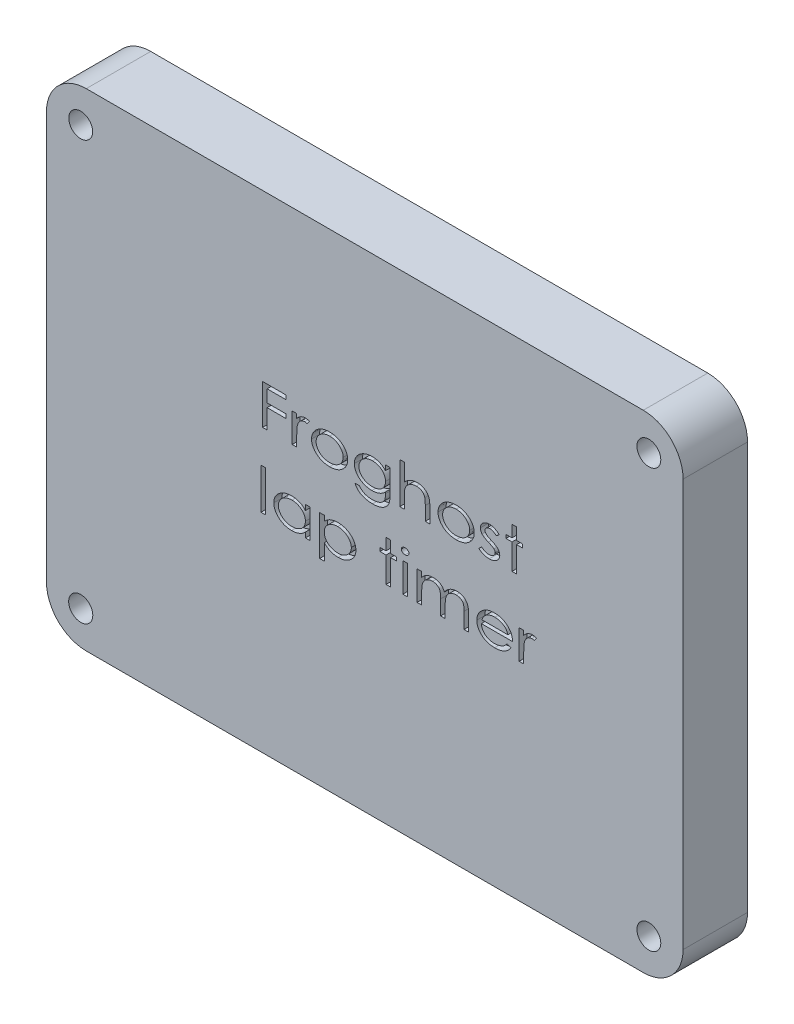
from build123d import *

# Parameters (mm, degrees)
ESQUISSE1_W             = 80
ESQUISSE1_H             = 61.2
ESQUISSE1_R             = 1.5
ESQUISSE1_R_2           = 1.497381554
ESQUISSE1_R_3           = 1.516159075
BOSS_EXTRU_1_DEPTH      = 6.1
ESQUISSE2_W             = 80
ESQUISSE2_H             = 61.2
BOSS_EXTRU_2_DEPTH      = 2
CONG_1_R                = 5
ESQUISSE3_R             = 1.5
ESQUISSE3_R_2           = 1.516159075
ESQUISSE3_R_3           = 1.497381554
ENL_V_MAT_EXTRU_1_DEPTH = 18
ESQUISSE4_W             = 0.576923077
ESQUISSE4_H             = 5.128205128
ESQUISSE4_H_2           = 3.653846154
ENL_V_MAT_EXTRU_2_DEPTH = 1


with BuildPart() as part:
    # Esquisse1 → Boss.-Extru.1 (new body)
    with BuildSketch(Plane.XY):
        with Locations((11.099287317, -7.392133332)):
            Rectangle(ESQUISSE1_W, ESQUISSE1_H)
        with Locations((-24.600712683, 18.907866668)):
            Circle(ESQUISSE1_R, mode=Mode.SUBTRACT)
        with Locations((46.799287317, 18.907866668)):
            Circle(ESQUISSE1_R, mode=Mode.SUBTRACT)
        with Locations((46.799866202, -33.694686986)):
            Circle(ESQUISSE1_R_2, mode=Mode.SUBTRACT)
        with Locations((-24.596108716, -33.707622657)):
            Circle(ESQUISSE1_R_3, mode=Mode.SUBTRACT)
        with BuildLine():
            Line((-22.700712683, 21.207866668), (44.696667897, 21.207866668))
            ThreePointArc((44.696667897, 21.207866668), (44.797977607, 16.906556958), (49.099287317, 17.007866668))
            Line((49.099287317, 17.007866668), (49.099287317, -31.792133332))
            ThreePointArc((49.099287317, -31.792133332), (44.92039338, -31.813239396), (44.899287317, -35.992133332))
            Line((44.899287317, -35.992133332), (-22.700712683, -35.992133332))
            ThreePointArc((-22.700712683, -35.992133332), (-22.700712683, -31.792133332), (-26.900712683, -31.792133332))
            Line((-26.900712683, -31.792133332), (-26.900712683, 17.007866668))
            ThreePointArc((-26.900712683, 17.007866668), (-22.491210372, 16.798364357), (-22.700712683, 21.207866668))
        make_face(mode=Mode.SUBTRACT)
    extrude(amount=BOSS_EXTRU_1_DEPTH)

    # Esquisse2 → Boss.-Extru.2 (add)
    with BuildSketch(Plane.XY.offset(6.1)):
        with Locations((11.099287317, -7.392133332)):
            Rectangle(ESQUISSE2_W, ESQUISSE2_H)
    extrude(amount=BOSS_EXTRU_2_DEPTH)

    # Congé1
    cong_1_edges = [part.edges().sort_by_distance(p)[0] for p in [
        (-28.900712683, 23.207866668, 4.05),
        (51.099287317, 23.207866668, 4.05),
        (51.099287317, -37.992133332, 4.05),
        (-28.900712683, -37.992133332, 4.05),
    ]]
    fillet(cong_1_edges, radius=CONG_1_R)

    # Esquisse3 → Enlèv. mat.-Extru.1 (cut)
    with BuildSketch(Plane(origin=(0, 0, 0), x_dir=(-1, 0, 0), z_dir=(0, 0, -1))):
        with Locations(Location((-46.799287317, 18.907866668, 0), (0, 0, 180))):
            Circle(ESQUISSE3_R)
        with Locations(Location((24.600712683, 18.907866668, 0), (0, 0, 180))):
            Circle(ESQUISSE3_R)
        with Locations(Location((24.596108716, -33.707622657, 0), (0, 0, 180))):
            Circle(ESQUISSE3_R_2)
        with Locations(Location((-46.799866202, -33.694686986, 0), (0, 0, 180))):
            Circle(ESQUISSE3_R_3)
    extrude(amount=-ENL_V_MAT_EXTRU_1_DEPTH, mode=Mode.SUBTRACT)

    # Esquisse4 → Enlèv. mat.-Extru.2 (cut)
    # profile 1 of 17: a face of its own
    with BuildSketch(Plane.XY.offset(8.1)):
        Polygon((-1.7457889, 2.417352805), (1.202929049, 2.417352805), (1.202929049, 1.904532292), (-1.168865823, 1.904532292), (-1.168865823, 0.366070754), (1.202929049, 0.366070754), (1.202929049, -0.146749759), (-1.168865823, -0.146749759), (-1.168865823, -2.582647195), (-1.7457889, -2.582647195), align=None)
    # profile 2 of 17: a face of its own
    with BuildSketch(Plane.XY.offset(8.1)):
        with BuildLine():
            Line((1.972159818, 1.071198959), (2.549082895, 1.071198959))
            Line((2.549082895, 1.071198959), (2.549082895, 0.533338382))
            add(Edge.make_bspline(
                [(2.549082895, 0.533338382), (2.590898267, 0.58357823), (2.671555938, 0.680485871), (2.803193509, 0.807416125), (2.938487436, 0.912067037), (3.077485244, 0.995077542), (3.220253854, 1.057255576), (3.365037599, 1.103312586), (3.513656403, 1.129815272), (3.613686509, 1.133468755), (3.663866549, 1.135301523)],
                knots=[0, 0, 0, 0, 1.193658677, 2.302448217, 3.333465471, 4.312705537, 5.252324839, 6.172656765, 7.083314411, 8, 8, 8, 8], degree=3))
            add(Edge.make_bspline(
                [(3.663866549, 1.135301523), (3.702698242, 1.133600336), (3.782334933, 1.130111511), (3.903060423, 1.105877857), (4.027640721, 1.066470265), (4.109269099, 1.029364763), (4.151646997, 1.010101203)],
                knots=[0, 0, 0, 0, 0.917703527, 1.882041823, 2.900448349, 4, 4, 4, 4], degree=3))
            Line((4.151646997, 1.010101203), (3.859179049, 0.621479408))
            add(Edge.make_bspline(
                [(3.859179049, 0.621479408), (3.831551033, 0.631073725), (3.779357929, 0.649198702), (3.703494637, 0.671338009), (3.63389818, 0.683723854), (3.589452859, 0.685673741), (3.568714305, 0.686583574)],
                knots=[0, 0, 0, 0, 1.173299391, 2.216523101, 3.167814971, 4, 4, 4, 4], degree=3))
            add(Edge.make_bspline(
                [(3.568714305, 0.686583574), (3.523066476, 0.684276898), (3.431350317, 0.679642295), (3.295926615, 0.641175619), (3.163391196, 0.580090448), (3.057500459, 0.510443596), (2.975364309, 0.44422088), (2.918466918, 0.385073085), (2.863999674, 0.320709111), (2.812622551, 0.249846436), (2.767210715, 0.170965199), (2.723628047, 0.086745689), (2.684714574, -0.004397743), (2.662552867, -0.068150507), (2.651246356, -0.100676041)],
                knots=[0, 0, 0, 0, 1.267924812, 2.547529573, 3.885648399, 5.315257258, 6.060816241, 6.816029851, 7.593692966, 8.405539728, 9.24650386, 10.122873872, 11.042323403, 12, 12, 12, 12], degree=3))
            add(Edge.make_bspline(
                [(2.651246356, -0.100676041), (2.64278989, -0.129612084), (2.624116167, -0.193509182), (2.604098925, -0.301142598), (2.587542966, -0.428573179), (2.574191651, -0.575639152), (2.561727685, -0.742210099), (2.554108942, -0.92860292), (2.550663053, -1.134984176), (2.549625598, -1.279227301), (2.549082895, -1.354682451)],
                knots=[0, 0, 0, 0, 0.573131189, 1.265598738, 2.079306811, 3.017055669, 4.073990921, 5.25627755, 6.564728891, 8, 8, 8, 8], degree=3))
            Line((2.549082895, -1.354682451), (2.549082895, -2.582647195))
            Line((2.549082895, -2.582647195), (1.972159818, -2.582647195))
            Line((1.972159818, -2.582647195), (1.972159818, 1.071198959))
        make_face()
    # profile 3 of 17: a face of its own
    with BuildSketch(Plane.XY.offset(8.1)):
        with BuildLine():
            add(Edge.make_bspline(
                [(6.685701485, 1.135301523), (6.767926636, 1.133814617), (6.929574644, 1.13089148), (7.166397364, 1.100621467), (7.392602791, 1.053895191), (7.60840326, 0.989223611), (7.812317472, 0.903286954), (8.005727127, 0.799789675), (8.188714818, 0.677360096), (8.300204344, 0.581589267), (8.356374561, 0.533338382)],
                knots=[0, 0, 0, 0, 1.084830271, 2.132688704, 3.145650297, 4.131276902, 5.101142159, 6.06133745, 7.023270615, 8, 8, 8, 8], degree=3))
            add(Edge.make_bspline(
                [(8.356374561, 0.533338382), (8.404464625, 0.48755832), (8.498789178, 0.397764639), (8.620442383, 0.249197944), (8.726200535, 0.096575552), (8.81217176, -0.063474431), (8.877002364, -0.230668061), (8.924376421, -0.403440638), (8.954819635, -0.582372092), (8.957822116, -0.704186083), (8.959339305, -0.765740143)],
                knots=[0, 0, 0, 0, 1.078139912, 2.114679361, 3.114009473, 4.092288667, 5.059596781, 6.02185444, 7.000419498, 8, 8, 8, 8], degree=3))
            add(Edge.make_bspline(
                [(8.959339305, -0.765740143), (8.957490079, -0.827638332), (8.953829291, -0.950173988), (8.92227784, -1.130457191), (8.873604103, -1.305541034), (8.802697178, -1.473887976), (8.71270937, -1.636959612), (8.602002703, -1.793013701), (8.471347869, -1.943094507), (8.323502488, -2.085817342), (8.160546896, -2.218030431), (7.983090067, -2.332152588), (7.795002277, -2.430327881), (7.5946264, -2.509004034), (7.383582623, -2.571516849), (7.160947288, -2.61527757), (6.927054347, -2.64156203), (6.767234327, -2.644997261), (6.685701485, -2.646749759)],
                knots=[0, 0, 0, 0, 0.904967769, 1.791503467, 2.669778811, 3.558773624, 4.457351764, 5.389732271, 6.352404915, 7.364552137, 8.392870792, 9.417144319, 10.446135616, 11.491962056, 12.561496981, 13.662177698, 14.807350315, 16, 16, 16, 16], degree=3))
            add(Edge.make_bspline(
                [(6.685701485, -2.646749759), (6.603834687, -2.64499877), (6.44334859, -2.641566252), (6.208463544, -2.615255582), (5.985126689, -2.57164742), (5.773748514, -2.509039072), (5.57321283, -2.430048103), (5.38444259, -2.332503837), (5.206803615, -2.217662582), (5.042917529, -2.086193389), (4.895157531, -1.942996548), (4.764248948, -1.793353091), (4.65482647, -1.636626872), (4.564638784, -1.473930918), (4.493808391, -1.305529742), (4.44511445, -1.130460216), (4.413568365, -0.950173211), (4.409906848, -0.827638071), (4.408057254, -0.765740143)],
                knots=[0, 0, 0, 0, 1.196045726, 2.344646605, 3.448747233, 4.516955666, 5.561485018, 6.593533137, 7.616536308, 8.647384558, 9.658276463, 10.61975515, 11.548176474, 12.445640151, 13.333532386, 14.210718448, 15.096154619, 16, 16, 16, 16], degree=3))
            add(Edge.make_bspline(
                [(4.408057254, -0.765740143), (4.409579841, -0.704516892), (4.412601129, -0.58303083), (4.443145272, -0.404491722), (4.489883185, -0.23166878), (4.556648524, -0.065929057), (4.641527251, 0.094161844), (4.74636342, 0.246995435), (4.86898769, 0.394775142), (4.96299764, 0.484498827), (5.011021997, 0.530333574)],
                knots=[0, 0, 0, 0, 0.996090355, 1.976554501, 2.9406796, 3.906810568, 4.879633339, 5.885394343, 6.919767756, 8, 8, 8, 8], degree=3))
            add(Edge.make_bspline(
                [(5.011021997, 0.530333574), (5.067135669, 0.578993753), (5.178354455, 0.675439517), (5.362176824, 0.797800821), (5.555783917, 0.902594591), (5.76097197, 0.987663148), (5.976575405, 1.054258457), (6.203358921, 1.100611549), (6.440823665, 1.130903624), (6.603140672, 1.133818767), (6.685701485, 1.135301523)],
                knots=[0, 0, 0, 0, 0.97674147, 1.935927491, 2.899331942, 3.870482242, 4.854580139, 5.864648857, 6.913876432, 8, 8, 8, 8], degree=3))
        make_face()
        with BuildLine():
            add(Edge.make_bspline(
                [(6.683698279, 0.686583574), (6.626549187, 0.685197088), (6.513899097, 0.6824641), (6.348345449, 0.662041469), (6.188921294, 0.628763417), (6.035320447, 0.583278631), (5.888229682, 0.522140286), (5.746815514, 0.449329005), (5.611634216, 0.362503574), (5.484992836, 0.263128049), (5.368249421, 0.154975619), (5.265671191, 0.039765004), (5.178770458, -0.080941461), (5.107725883, -0.207547526), (5.052469, -0.339958098), (5.013288085, -0.478125422), (4.989654097, -0.621698135), (4.9865537, -0.719243352), (4.984980331, -0.768744951)],
                knots=[0, 0, 0, 0, 1.104667212, 2.17747748, 3.219316569, 4.250544466, 5.269396084, 6.294241117, 7.321968413, 8.370404829, 9.402541342, 10.394730436, 11.347658633, 12.272385255, 13.19539825, 14.114815826, 15.043319244, 16, 16, 16, 16], degree=3))
            add(Edge.make_bspline(
                [(4.984980331, -0.768744951), (4.987546333, -0.832767373), (4.992657157, -0.960283745), (5.038029879, -1.147327737), (5.109533431, -1.327792478), (5.210262902, -1.498182011), (5.334224506, -1.656101397), (5.479229021, -1.797636404), (5.645564687, -1.91855758), (5.829935627, -2.019158417), (6.028711398, -2.099033389), (6.238844674, -2.155810484), (6.458052865, -2.192492705), (6.607762024, -2.19616774), (6.683698279, -2.19803181)],
                knots=[0, 0, 0, 0, 0.932622684, 1.857547055, 2.790779812, 3.75545055, 4.733536497, 5.711573951, 6.70118165, 7.723336121, 8.767798276, 9.81805688, 10.893263495, 12, 12, 12, 12], degree=3))
            add(Edge.make_bspline(
                [(6.683698279, -2.19803181), (6.759634535, -2.19616774), (6.909343694, -2.192492705), (7.128551885, -2.155810484), (7.338685161, -2.099033389), (7.537460932, -2.019158417), (7.721831871, -1.91855758), (7.888167538, -1.797636404), (8.033172053, -1.656101397), (8.157133657, -1.498182011), (8.257863128, -1.327792478), (8.32936668, -1.147327737), (8.374739401, -0.960283745), (8.379850226, -0.832767373), (8.382416228, -0.768744951)],
                knots=[0, 0, 0, 0, 1.106736505, 2.18194312, 3.232201724, 4.276663879, 5.29881835, 6.288426049, 7.266463503, 8.24454945, 9.209220188, 10.142452945, 11.067377316, 12, 12, 12, 12], degree=3))
            add(Edge.make_bspline(
                [(8.382416228, -0.768744951), (8.38080454, -0.719255769), (8.377628633, -0.621735019), (8.354531686, -0.477891866), (8.313276463, -0.340432039), (8.260223243, -0.206976537), (8.187325697, -0.081271622), (8.100796841, 0.039777879), (7.99811528, 0.155325295), (7.880391656, 0.262735805), (7.753706478, 0.362929328), (7.617880694, 0.448711172), (7.477002958, 0.522460092), (7.33004192, 0.583220672), (7.176481409, 0.628787037), (7.017366549, 0.6619373), (6.852502614, 0.682481928), (6.740515048, 0.685203028), (6.683698279, 0.686583574)],
                knots=[0, 0, 0, 0, 0.957034769, 1.885881774, 2.807428394, 3.728318761, 4.656559594, 5.609840415, 6.602396663, 7.639648918, 8.688473302, 9.722020929, 10.741515424, 11.760744061, 12.792353557, 13.834578172, 14.901375603, 16, 16, 16, 16], degree=3))
        make_face(mode=Mode.SUBTRACT)
    # profile 4 of 17: a face of its own
    with BuildSketch(Plane.XY.offset(8.1)):
        with BuildLine():
            Line((13.702929049, 1.071198959), (14.279852126, 1.071198959))
            Line((14.279852126, 1.071198959), (14.279852126, -1.828440464))
            add(Edge.make_bspline(
                [(14.279852126, -1.828440464), (14.279696182, -1.89021815), (14.279395106, -2.009491121), (14.270681667, -2.181810157), (14.259232286, -2.341207535), (14.242692412, -2.488051627), (14.219591135, -2.621677788), (14.192713402, -2.742813515), (14.161698395, -2.851380412), (14.134514009, -2.917717503), (14.12159892, -2.949233733)],
                knots=[0, 0, 0, 0, 1.301533202, 2.51284472, 3.634575474, 4.668610574, 5.625072911, 6.490366044, 7.282784772, 8, 8, 8, 8], degree=3))
            add(Edge.make_bspline(
                [(14.12159892, -2.949233733), (14.102688722, -2.990369636), (14.065183985, -3.071954779), (13.995115843, -3.186955486), (13.914602693, -3.293987442), (13.825164431, -3.394865238), (13.725486109, -3.488256156), (13.615810803, -3.574527588), (13.4964279, -3.653933876), (13.367092484, -3.724520624), (13.229557475, -3.787834476), (13.084427884, -3.842289039), (12.933253505, -3.890132127), (12.774569726, -3.926314139), (12.609954682, -3.956929313), (12.437968762, -3.977268491), (12.259511353, -3.991010702), (12.138119336, -3.992265081), (12.076326485, -3.992903605)],
                knots=[0, 0, 0, 0, 0.892361144, 1.769826507, 2.649562032, 3.531070128, 4.425493976, 5.339743849, 6.280293132, 7.249898151, 8.242834287, 9.264015286, 10.305378017, 11.367518935, 12.471830068, 13.606296802, 14.781520001, 16, 16, 16, 16], degree=3))
            add(Edge.make_bspline(
                [(12.076326485, -3.992903605), (11.986436464, -3.991676275), (11.810930782, -3.989279976), (11.555105468, -3.961578391), (11.312573805, -3.922215498), (11.086050635, -3.86282362), (10.876876723, -3.790041347), (10.686622151, -3.706121297), (10.516081997, -3.611384627), (10.363449321, -3.501845383), (10.225497611, -3.371732005), (10.094796708, -3.218913105), (9.969367815, -3.040106785), (9.895321545, -2.907887157), (9.856775202, -2.839057451)],
                knots=[0, 0, 0, 0, 1.220149806, 2.382280289, 3.490641873, 4.554024904, 5.557741845, 6.495463758, 7.374449758, 8.202461232, 9.039706035, 9.943084277, 10.9292293, 12, 12, 12, 12], degree=3))
            Line((9.856775202, -2.839057451), (10.433698279, -2.839057451))
            add(Edge.make_bspline(
                [(10.433698279, -2.839057451), (10.47579648, -2.896537611), (10.558841787, -3.009926246), (10.711296445, -3.154896433), (10.879173369, -3.278218615), (11.033860359, -3.360815835), (11.166462418, -3.413261166), (11.272105811, -3.448437723), (11.383663606, -3.478877055), (11.501285257, -3.502001473), (11.62447526, -3.521749307), (11.753612326, -3.534057542), (11.888585159, -3.542344014), (11.980493332, -3.543564687), (12.027247959, -3.544185656)],
                knots=[0, 0, 0, 0, 1.406411641, 2.774367649, 4.13970867, 5.515970748, 6.226996413, 6.957671546, 7.716753095, 8.511703955, 9.326821042, 10.182754768, 11.075548767, 12, 12, 12, 12], degree=3))
            add(Edge.make_bspline(
                [(12.027247959, -3.544185656), (12.073334465, -3.543561369), (12.163907445, -3.542334467), (12.296887008, -3.534100747), (12.424652809, -3.521548926), (12.54658895, -3.502276792), (12.663424625, -3.478576323), (12.774386008, -3.448469916), (12.880011311, -3.413254341), (12.980264015, -3.373621727), (13.073591132, -3.32815168), (13.161164502, -3.281800681), (13.240752777, -3.230990621), (13.314103135, -3.178319033), (13.380093234, -3.122055244), (13.439850946, -3.063919669), (13.492100959, -3.002536195), (13.538511733, -2.93728119), (13.577980606, -2.864648816), (13.612386228, -2.782935206), (13.639460666, -2.689929942), (13.663910338, -2.587114081), (13.681213623, -2.47318468), (13.694477832, -2.348884694), (13.700754365, -2.213786012), (13.702187364, -2.120244612), (13.702929049, -2.071829887)],
                knots=[0, 0, 0, 0, 1.284615551, 2.524631777, 3.71274724, 4.861840311, 5.964270962, 7.034369188, 8.064422103, 9.066774622, 10.036673369, 10.956946004, 11.82705178, 12.666609064, 13.47215512, 14.242132945, 14.988114445, 15.716233977, 16.470126793, 17.287679463, 18.182663732, 19.166922939, 20.231828452, 21.392172702, 22.650252828, 24, 24, 24, 24], degree=3))
            Line((13.702929049, -2.071829887), (13.702929049, -1.882527002))
            add(Edge.make_bspline(
                [(13.702929049, -1.882527002), (13.649371036, -1.936922283), (13.54216066, -2.045808673), (13.358775362, -2.186275737), (13.15865515, -2.306706888), (12.943163245, -2.406343648), (12.716129394, -2.485711872), (12.480050983, -2.541016955), (12.237343168, -2.576792091), (12.073114359, -2.58068268), (11.990188664, -2.582647195)],
                knots=[0, 0, 0, 0, 0.9616226, 1.924939268, 2.903225655, 3.90145387, 4.913304235, 5.930317158, 6.954934346, 8, 8, 8, 8], degree=3))
            add(Edge.make_bspline(
                [(11.990188664, -2.582647195), (11.941416666, -2.581900415), (11.844059363, -2.580409713), (11.699348913, -2.567691177), (11.556800566, -2.549206816), (11.416749448, -2.521701046), (11.278843269, -2.487045766), (11.143346238, -2.443403816), (11.009733829, -2.393497671), (10.879225556, -2.33577698), (10.753710255, -2.270807705), (10.634421101, -2.200979295), (10.522493498, -2.125602525), (10.418410867, -2.044245783), (10.320994144, -1.958341853), (10.231313677, -1.866587615), (10.14919909, -1.769591301), (10.075084026, -1.667332464), (10.009159324, -1.561059069), (9.950641213, -1.452397012), (9.902650314, -1.340160417), (9.86237862, -1.226186746), (9.830999983, -1.109338396), (9.809518451, -0.989694947), (9.794401788, -0.867621053), (9.793250985, -0.785151013), (9.792672638, -0.743704887)],
                knots=[0, 0, 0, 0, 1.102496069, 2.200771917, 3.282212953, 4.351067109, 5.425742796, 6.495236474, 7.567789237, 8.649230273, 9.719442957, 10.761602243, 11.772820946, 12.767879558, 13.746423923, 14.707251758, 15.666031455, 16.617263585, 17.559830464, 18.491849916, 19.404720472, 20.31668551, 21.223041296, 22.136535823, 23.063497827, 24, 24, 24, 24], degree=3))
            add(Edge.make_bspline(
                [(9.792672638, -0.743704887), (9.793815387, -0.702277438), (9.796097056, -0.619561304), (9.808907281, -0.496555274), (9.831978607, -0.375568849), (9.865746267, -0.257419897), (9.906374803, -0.140495838), (9.957731825, -0.026465088), (10.018510957, 0.085347846), (10.087174554, 0.194905579), (10.163880635, 0.301161681), (10.249384805, 0.400868969), (10.340943086, 0.496010649), (10.440089125, 0.584521306), (10.545570733, 0.66861314), (10.659194624, 0.744924432), (10.778574788, 0.817942948), (10.905061247, 0.883169602), (11.035986513, 0.94181012), (11.168917905, 0.994679098), (11.30454001, 1.036837292), (11.441172488, 1.074144071), (11.580334477, 1.100169157), (11.720610881, 1.1206349), (11.862761764, 1.133035851), (11.958113437, 1.134541824), (12.006214305, 1.135301523)],
                knots=[0, 0, 0, 0, 0.927022606, 1.850940105, 2.763646773, 3.678917571, 4.597960441, 5.530863249, 6.473405952, 7.443374224, 8.422047587, 9.402429927, 10.379733957, 11.374159407, 12.373957143, 13.39539851, 14.434361868, 15.503500072, 16.57672747, 17.643462173, 18.701820727, 19.752719066, 20.810444757, 21.866850764, 22.923916819, 24, 24, 24, 24], degree=3))
            add(Edge.make_bspline(
                [(12.006214305, 1.135301523), (12.085102516, 1.133386516), (12.240418615, 1.129616227), (12.469289283, 1.099449102), (12.690123377, 1.052051563), (12.904242089, 0.983279971), (13.113432508, 0.890840265), (13.316470223, 0.766644053), (13.515932468, 0.613809193), (13.639341956, 0.493939649), (13.702929049, 0.432176523)],
                knots=[0, 0, 0, 0, 1.000657623, 1.970107281, 2.924012196, 3.863137721, 4.818884552, 5.818573257, 6.876013614, 8, 8, 8, 8], degree=3))
            Line((13.702929049, 0.432176523), (13.702929049, 1.071198959))
        make_face()
        with BuildLine():
            add(Edge.make_bspline(
                [(12.073321677, 0.686583574), (11.997713886, 0.684348025), (11.847961287, 0.679920182), (11.628025879, 0.642354847), (11.415524085, 0.58382762), (11.214806667, 0.499279634), (11.02724653, 0.396822534), (10.86052261, 0.271921004), (10.713775269, 0.13028638), (10.590687398, -0.029159821), (10.49254317, -0.200816404), (10.421270851, -0.381450567), (10.377577798, -0.569351972), (10.372264852, -0.697402998), (10.369595715, -0.761733733)],
                knots=[0, 0, 0, 0, 1.094811094, 2.168437986, 3.223641393, 4.281933969, 5.317030878, 6.312588996, 7.290981033, 8.263423301, 9.221049352, 10.146311928, 11.068737512, 12, 12, 12, 12], degree=3))
            add(Edge.make_bspline(
                [(10.369595715, -0.761733733), (10.370791109, -0.810239621), (10.373145346, -0.9057683), (10.396320948, -1.045696185), (10.431502704, -1.179477416), (10.483792652, -1.306292931), (10.549870714, -1.426655293), (10.630997764, -1.540476925), (10.725496922, -1.648372135), (10.834741121, -1.747879692), (10.955170478, -1.838353024), (11.084688192, -1.918092722), (11.223606913, -1.984330179), (11.370534775, -2.039723276), (11.526781816, -2.081042917), (11.690639695, -2.112687504), (11.863587463, -2.130577995), (11.981802254, -2.132795128), (12.042271997, -2.133929246)],
                knots=[0, 0, 0, 0, 0.96111248, 1.892838345, 2.805071872, 3.698884346, 4.60559943, 5.522242918, 6.465191984, 7.44453383, 8.446901343, 9.448393885, 10.455190158, 11.494316124, 12.557523497, 13.656033041, 14.80100385, 16, 16, 16, 16], degree=3))
            add(Edge.make_bspline(
                [(12.042271997, -2.133929246), (12.10308163, -2.132817362), (12.222306458, -2.130637374), (12.396431917, -2.112360648), (12.561623292, -2.082590697), (12.717437771, -2.040401003), (12.864518968, -1.986934553), (13.001240187, -1.918563298), (13.13019893, -1.841095707), (13.248145555, -1.750444734), (13.355412097, -1.65128384), (13.447916912, -1.542254575), (13.526688082, -1.426497453), (13.59145013, -1.303264317), (13.641664732, -1.172120585), (13.677740464, -1.033439426), (13.699088627, -0.88693144), (13.701630117, -0.786845218), (13.702929049, -0.735692067)],
                knots=[0, 0, 0, 0, 1.19578733, 2.34448939, 3.439297077, 4.493839214, 5.516052018, 6.51161546, 7.495918654, 8.470447695, 9.432171157, 10.363808737, 11.27629551, 12.180975096, 13.095609538, 14.032140546, 14.994245053, 16, 16, 16, 16], degree=3))
            add(Edge.make_bspline(
                [(13.702929049, -0.735692067), (13.700548528, -0.669053044), (13.695887765, -0.538582124), (13.655531478, -0.348389571), (13.589085625, -0.16996943), (13.496924634, -0.003508212), (13.3815991, 0.149628897), (13.241719521, 0.285335087), (13.080745387, 0.404555254), (12.899938642, 0.50469117), (12.7050257, 0.584552386), (12.50132612, 0.645145925), (12.289479131, 0.679205147), (12.145885784, 0.684106635), (12.073321677, 0.686583574)],
                knots=[0, 0, 0, 0, 0.993273759, 1.944706513, 2.885586036, 3.824102814, 4.773434307, 5.734969173, 6.721162128, 7.75352746, 8.809825341, 9.857965814, 10.917534828, 12, 12, 12, 12], degree=3))
        make_face(mode=Mode.SUBTRACT)
    # profile 5 of 17: a face of its own
    with BuildSketch(Plane.XY.offset(8.1)):
        with BuildLine():
            Line((15.497800844, 2.545557933), (16.07472392, 2.545557933))
            Line((16.07472392, 2.545557933), (16.07472392, 0.381094792))
            add(Edge.make_bspline(
                [(16.07472392, 0.381094792), (16.130933808, 0.441443574), (16.241120842, 0.559743994), (16.424205237, 0.712821012), (16.613441358, 0.844630411), (16.812762466, 0.950460231), (17.020305069, 1.033227206), (17.236595909, 1.092390618), (17.461409435, 1.128345855), (17.614055395, 1.132964167), (17.691310459, 1.135301523)],
                knots=[0, 0, 0, 0, 1.07415008, 2.105633337, 3.103998732, 4.075565931, 5.040540589, 6.010859238, 6.993283574, 8, 8, 8, 8], degree=3))
            add(Edge.make_bspline(
                [(17.691310459, 1.135301523), (17.731064624, 1.134836703), (17.809369406, 1.133921136), (17.925044796, 1.123301222), (18.037390467, 1.107381894), (18.146612421, 1.085716125), (18.252360169, 1.05648945), (18.354562532, 1.020175501), (18.453674288, 0.978261406), (18.548944879, 0.930453219), (18.638695991, 0.875951463), (18.72385922, 0.818506854), (18.80258658, 0.755934963), (18.87501705, 0.688704205), (18.94094217, 0.616386819), (19.001455166, 0.540461463), (19.054607775, 0.459253813), (19.103648429, 0.373504132), (19.146545209, 0.278516605), (19.181982596, 0.172334674), (19.211458421, 0.053936442), (19.238243664, -0.076179228), (19.255925635, -0.219239619), (19.270418846, -0.374191883), (19.277945325, -0.541307898), (19.279202205, -0.656893479), (19.279852126, -0.716661618)],
                knots=[0, 0, 0, 0, 1.021683283, 2.012435314, 2.983473585, 3.937869172, 4.872808728, 5.801185558, 6.724190829, 7.637729951, 8.538560957, 9.421760501, 10.276949778, 11.121084872, 11.959396615, 12.790471507, 13.614111827, 14.451940127, 15.327769077, 16.288588017, 17.325266595, 18.463133286, 19.701266581, 21.028475566, 22.463454662, 24, 24, 24, 24], degree=3))
            Line((19.279852126, -0.716661618), (19.279852126, -2.582647195))
            Line((19.279852126, -2.582647195), (18.702929049, -2.582647195))
            Line((18.702929049, -2.582647195), (18.702929049, -0.863897195))
            add(Edge.make_bspline(
                [(18.702929049, -0.863897195), (18.70279816, -0.814147553), (18.702547775, -0.718978817), (18.698998867, -0.582773951), (18.695968004, -0.45915139), (18.688355691, -0.348685115), (18.680975105, -0.2510726), (18.670825402, -0.166573013), (18.659843605, -0.094785716), (18.648801075, -0.051869439), (18.643834497, -0.032567067)],
                knots=[0, 0, 0, 0, 1.429454469, 2.734479441, 3.915096125, 4.982083123, 5.9158061, 6.72734519, 7.427600459, 8, 8, 8, 8], degree=3))
            add(Edge.make_bspline(
                [(18.643834497, -0.032567067), (18.634916398, -0.003377997), (18.617463727, 0.053744855), (18.584483678, 0.13545296), (18.544560137, 0.210930185), (18.501446351, 0.282013332), (18.45145207, 0.346550931), (18.397582218, 0.405959752), (18.33773289, 0.459481909), (18.272789621, 0.50764358), (18.202211591, 0.549272425), (18.12744481, 0.587429749), (18.046609366, 0.617695123), (17.96052693, 0.642899009), (17.869859263, 0.662810449), (17.773486682, 0.676955223), (17.672072592, 0.684626087), (17.602513685, 0.685923339), (17.567111741, 0.686583574)],
                knots=[0, 0, 0, 0, 1.040890899, 2.037017845, 2.999772166, 3.951073996, 4.869069183, 5.779972212, 6.683224964, 7.603478097, 8.53319658, 9.475456454, 10.463214634, 11.472278836, 12.533409461, 13.627045924, 14.792287113, 16, 16, 16, 16], degree=3))
            add(Edge.make_bspline(
                [(17.567111741, 0.686583574), (17.526011462, 0.685910792), (17.444932062, 0.68458358), (17.324694744, 0.671074773), (17.207969136, 0.648942764), (17.093693408, 0.619401833), (16.984127996, 0.578501539), (16.876390521, 0.531635987), (16.77296363, 0.474260556), (16.67293023, 0.409694441), (16.580000124, 0.337712216), (16.49286607, 0.262645489), (16.414741609, 0.182588733), (16.345394992, 0.097909612), (16.283837583, 0.00981681), (16.231528902, -0.083218102), (16.187286226, -0.18009917), (16.164319738, -0.247366989), (16.15284892, -0.280964502)],
                knots=[0, 0, 0, 0, 1.077093923, 2.124806198, 3.16676328, 4.190026369, 5.214449133, 6.229293254, 7.267272823, 8.311139597, 9.347457364, 10.346171291, 11.324074378, 12.275494987, 13.212638205, 14.137563464, 15.069789411, 16, 16, 16, 16], degree=3))
            add(Edge.make_bspline(
                [(16.15284892, -0.280964502), (16.146525663, -0.305267688), (16.13276291, -0.35816428), (16.117659535, -0.445615086), (16.10295053, -0.547039485), (16.094522763, -0.662874911), (16.084514402, -0.792654099), (16.079425065, -0.936318999), (16.074887963, -1.094236512), (16.074780233, -1.204103685), (16.07472392, -1.261533413)],
                knots=[0, 0, 0, 0, 0.610940434, 1.329729645, 2.15826949, 3.104343598, 4.155103487, 5.326215764, 6.602360509, 8, 8, 8, 8], degree=3))
            Line((16.07472392, -1.261533413), (16.07472392, -2.582647195))
            Line((16.07472392, -2.582647195), (15.497800844, -2.582647195))
            Line((15.497800844, -2.582647195), (15.497800844, 2.545557933))
        make_face()
    # profile 6 of 17: a face of its own
    with BuildSketch(Plane.XY.offset(8.1)):
        with BuildLine():
            add(Edge.make_bspline(
                [(22.583137382, 1.135301523), (22.665362534, 1.133814617), (22.827010542, 1.13089148), (23.063833261, 1.100621467), (23.290038688, 1.053895191), (23.505839158, 0.989223611), (23.709753369, 0.903286954), (23.903163025, 0.799789675), (24.086150715, 0.677360096), (24.197640242, 0.581589267), (24.253810459, 0.533338382)],
                knots=[0, 0, 0, 0, 1.084830271, 2.132688704, 3.145650297, 4.131276902, 5.101142159, 6.06133745, 7.023270615, 8, 8, 8, 8], degree=3))
            add(Edge.make_bspline(
                [(24.253810459, 0.533338382), (24.301900523, 0.48755832), (24.396225075, 0.397764639), (24.51787828, 0.249197944), (24.623636433, 0.096575552), (24.709607657, -0.063474431), (24.774438261, -0.230668061), (24.821812319, -0.403440638), (24.852255532, -0.582372092), (24.855258013, -0.704186083), (24.856775202, -0.765740143)],
                knots=[0, 0, 0, 0, 1.078139912, 2.114679361, 3.114009473, 4.092288667, 5.059596781, 6.02185444, 7.000419498, 8, 8, 8, 8], degree=3))
            add(Edge.make_bspline(
                [(24.856775202, -0.765740143), (24.854925976, -0.827638332), (24.851265188, -0.950173988), (24.819713737, -1.130457191), (24.77104, -1.305541034), (24.700133075, -1.473887976), (24.610145268, -1.636959612), (24.499438601, -1.793013701), (24.368783766, -1.943094507), (24.220938386, -2.085817342), (24.057982794, -2.218030431), (23.880525964, -2.332152588), (23.692438175, -2.430327881), (23.492062298, -2.509004034), (23.28101852, -2.571516849), (23.058383186, -2.61527757), (22.824490244, -2.64156203), (22.664670224, -2.644997261), (22.583137382, -2.646749759)],
                knots=[0, 0, 0, 0, 0.904967769, 1.791503467, 2.669778811, 3.558773624, 4.457351764, 5.389732271, 6.352404915, 7.364552137, 8.392870792, 9.417144319, 10.446135616, 11.491962056, 12.561496981, 13.662177698, 14.807350315, 16, 16, 16, 16], degree=3))
            add(Edge.make_bspline(
                [(22.583137382, -2.646749759), (22.501270584, -2.64499877), (22.340784488, -2.641566252), (22.105899442, -2.615255582), (21.882562586, -2.57164742), (21.671184412, -2.509039072), (21.470648728, -2.430048103), (21.281878487, -2.332503837), (21.104239513, -2.217662582), (20.940353426, -2.086193389), (20.792593428, -1.942996548), (20.661684846, -1.793353091), (20.552262368, -1.636626872), (20.462074681, -1.473930918), (20.391244289, -1.305529742), (20.342550347, -1.130460216), (20.311004263, -0.950173211), (20.307342746, -0.827638071), (20.305493151, -0.765740143)],
                knots=[0, 0, 0, 0, 1.196045726, 2.344646605, 3.448747233, 4.516955666, 5.561485018, 6.593533137, 7.616536308, 8.647384558, 9.658276463, 10.61975515, 11.548176474, 12.445640151, 13.333532386, 14.210718448, 15.096154619, 16, 16, 16, 16], degree=3))
            add(Edge.make_bspline(
                [(20.305493151, -0.765740143), (20.307015738, -0.704516892), (20.310037026, -0.58303083), (20.34058117, -0.404491722), (20.387319083, -0.23166878), (20.454084422, -0.065929057), (20.538963148, 0.094161844), (20.643799317, 0.246995435), (20.766423587, 0.394775142), (20.860433537, 0.484498827), (20.908457895, 0.530333574)],
                knots=[0, 0, 0, 0, 0.996090355, 1.976554501, 2.9406796, 3.906810568, 4.879633339, 5.885394343, 6.919767756, 8, 8, 8, 8], degree=3))
            add(Edge.make_bspline(
                [(20.908457895, 0.530333574), (20.964571567, 0.578993753), (21.075790352, 0.675439517), (21.259612721, 0.797800821), (21.453219814, 0.902594591), (21.658407868, 0.987663148), (21.874011302, 1.054258457), (22.100794819, 1.100611549), (22.338259562, 1.130903624), (22.500576569, 1.133818767), (22.583137382, 1.135301523)],
                knots=[0, 0, 0, 0, 0.97674147, 1.935927491, 2.899331942, 3.870482242, 4.854580139, 5.864648857, 6.913876432, 8, 8, 8, 8], degree=3))
        make_face()
        with BuildLine():
            add(Edge.make_bspline(
                [(22.581134177, 0.686583574), (22.523985085, 0.685197088), (22.411334995, 0.6824641), (22.245781346, 0.662041469), (22.086357191, 0.628763417), (21.932756344, 0.583278631), (21.785665579, 0.522140286), (21.644251411, 0.449329005), (21.509070113, 0.362503574), (21.382428733, 0.263128049), (21.265685318, 0.154975619), (21.163107089, 0.039765004), (21.076206356, -0.080941461), (21.00516178, -0.207547526), (20.949904898, -0.339958098), (20.910723982, -0.478125422), (20.887089994, -0.621698135), (20.883989597, -0.719243352), (20.882416228, -0.768744951)],
                knots=[0, 0, 0, 0, 1.104667212, 2.17747748, 3.219316569, 4.250544466, 5.269396084, 6.294241117, 7.321968413, 8.370404829, 9.402541342, 10.394730436, 11.347658633, 12.272385255, 13.19539825, 14.114815826, 15.043319244, 16, 16, 16, 16], degree=3))
            add(Edge.make_bspline(
                [(20.882416228, -0.768744951), (20.884982231, -0.832767373), (20.890093055, -0.960283745), (20.935465776, -1.147327737), (21.006969329, -1.327792478), (21.107698799, -1.498182011), (21.231660403, -1.656101397), (21.376664918, -1.797636404), (21.543000585, -1.91855758), (21.727371524, -2.019158417), (21.926147295, -2.099033389), (22.136280571, -2.155810484), (22.355488762, -2.192492705), (22.505197921, -2.19616774), (22.581134177, -2.19803181)],
                knots=[0, 0, 0, 0, 0.932622684, 1.857547055, 2.790779812, 3.75545055, 4.733536497, 5.711573951, 6.70118165, 7.723336121, 8.767798276, 9.81805688, 10.893263495, 12, 12, 12, 12], degree=3))
            add(Edge.make_bspline(
                [(22.581134177, -2.19803181), (22.657070433, -2.19616774), (22.806779591, -2.192492705), (23.025987782, -2.155810484), (23.236121059, -2.099033389), (23.43489683, -2.019158417), (23.619267769, -1.91855758), (23.785603435, -1.797636404), (23.93060795, -1.656101397), (24.054569554, -1.498182011), (24.155299025, -1.327792478), (24.226802578, -1.147327737), (24.272175299, -0.960283745), (24.277286123, -0.832767373), (24.279852126, -0.768744951)],
                knots=[0, 0, 0, 0, 1.106736505, 2.18194312, 3.232201724, 4.276663879, 5.29881835, 6.288426049, 7.266463503, 8.24454945, 9.209220188, 10.142452945, 11.067377316, 12, 12, 12, 12], degree=3))
            add(Edge.make_bspline(
                [(24.279852126, -0.768744951), (24.278240437, -0.719255769), (24.27506453, -0.621735019), (24.251967583, -0.477891866), (24.210712361, -0.340432039), (24.157659141, -0.206976537), (24.084761594, -0.081271622), (23.998232739, 0.039777879), (23.895551178, 0.155325295), (23.777827554, 0.262735805), (23.651142376, 0.362929328), (23.515316591, 0.448711172), (23.374438855, 0.522460092), (23.227477817, 0.583220672), (23.073917307, 0.628787037), (22.914802446, 0.6619373), (22.749938511, 0.682481928), (22.637950946, 0.685203028), (22.581134177, 0.686583574)],
                knots=[0, 0, 0, 0, 0.957034769, 1.885881774, 2.807428394, 3.728318761, 4.656559594, 5.609840415, 6.602396663, 7.639648918, 8.688473302, 9.722020929, 10.741515424, 11.760744061, 12.792353557, 13.834578172, 14.901375603, 16, 16, 16, 16], degree=3))
        make_face(mode=Mode.SUBTRACT)
    # profile 7 of 17: a face of its own
    with BuildSketch(Plane.XY.offset(8.1)):
        with BuildLine():
            Line((27.997800844, 0.615469792), (27.63722392, 0.30196819))
            add(Edge.make_bspline(
                [(27.63722392, 0.30196819), (27.602941117, 0.332544325), (27.536253835, 0.392021356), (27.43180467, 0.469959286), (27.32856256, 0.536584475), (27.22590262, 0.591376472), (27.12356217, 0.633677492), (27.021606736, 0.664115822), (26.920110043, 0.682989922), (26.852377916, 0.685395226), (26.818914626, 0.686583574)],
                knots=[0, 0, 0, 0, 1.191143459, 2.317025185, 3.376493024, 4.376036135, 5.331378458, 6.243873407, 7.132379622, 8, 8, 8, 8], degree=3))
            add(Edge.make_bspline(
                [(26.818914626, 0.686583574), (26.778000054, 0.685057668), (26.698148942, 0.682079626), (26.583346438, 0.652734602), (26.477172122, 0.606487702), (26.383506683, 0.54171466), (26.304932997, 0.466010603), (26.245311656, 0.382499462), (26.208957139, 0.290755891), (26.204940946, 0.226823453), (26.202929049, 0.194796716)],
                knots=[0, 0, 0, 0, 1.126613547, 2.19876053, 3.246056558, 4.306150977, 5.322123348, 6.241830403, 7.119250902, 8, 8, 8, 8], degree=3))
            add(Edge.make_bspline(
                [(26.202929049, 0.194796716), (26.204920669, 0.165829131), (26.208934756, 0.107445301), (26.240548689, 0.021909256), (26.290289632, -0.0611931), (26.335504098, -0.110772985), (26.359179049, -0.136733733)],
                knots=[0, 0, 0, 0, 0.923464895, 1.861232764, 2.88011042, 4, 4, 4, 4], degree=3))
            add(Edge.make_bspline(
                [(26.359179049, -0.136733733), (26.373950639, -0.150720569), (26.405514019, -0.180607114), (26.462041595, -0.222252533), (26.527611214, -0.267623815), (26.605240211, -0.312862703), (26.69227485, -0.361525596), (26.791206725, -0.409857504), (26.899820588, -0.462524799), (26.977030958, -0.49593873), (27.017231933, -0.513336297)],
                knots=[0, 0, 0, 0, 0.640357809, 1.368292506, 2.208553831, 3.152034543, 4.197222919, 5.349749855, 6.620099349, 8, 8, 8, 8], degree=3))
            add(Edge.make_bspline(
                [(27.017231933, -0.513336297), (27.066089707, -0.53512159), (27.160361965, -0.57715684), (27.294958343, -0.642027777), (27.416977105, -0.707309608), (27.527604697, -0.770685404), (27.624865479, -0.835147655), (27.710627507, -0.898037064), (27.784292456, -0.960731992), (27.826528743, -1.005110684), (27.846558856, -1.02615681)],
                knots=[0, 0, 0, 0, 1.307861289, 2.523550029, 3.651918164, 4.690727197, 5.639318476, 6.502942042, 7.290036046, 8, 8, 8, 8], degree=3))
            add(Edge.make_bspline(
                [(27.846558856, -1.02615681), (27.879651395, -1.068128353), (27.944362495, -1.150201982), (28.011245387, -1.290564769), (28.055271693, -1.437818038), (28.059678996, -1.539659968), (28.061903408, -1.591060656)],
                knots=[0, 0, 0, 0, 1.035861265, 2.025584197, 3.003491674, 4, 4, 4, 4], degree=3))
            add(Edge.make_bspline(
                [(28.061903408, -1.591060656), (28.060817448, -1.627207134), (28.058671835, -1.698624439), (28.039505551, -1.803289672), (28.011424486, -1.904422204), (27.967714602, -2.000078393), (27.915317191, -2.093155563), (27.847901892, -2.180089422), (27.77043464, -2.263874783), (27.681750691, -2.342231608), (27.584516491, -2.413580969), (27.48058469, -2.476659518), (27.370048632, -2.528139905), (27.253964657, -2.57178653), (27.131974286, -2.605643185), (27.003670108, -2.629787387), (26.869637271, -2.643686168), (26.778214524, -2.645717777), (26.731775202, -2.646749759)],
                knots=[0, 0, 0, 0, 0.917983003, 1.813727822, 2.697369886, 3.578890162, 4.479966245, 5.406733975, 6.367575675, 7.377535281, 8.409575044, 9.429858185, 10.462456109, 11.504427907, 12.579268083, 13.676162811, 14.819577984, 16, 16, 16, 16], degree=3))
            add(Edge.make_bspline(
                [(26.731775202, -2.646749759), (26.668919182, -2.645336934), (26.54436638, -2.642537341), (26.360035728, -2.616239892), (26.180036933, -2.575270077), (26.005874049, -2.518704601), (25.841155545, -2.447446444), (25.690309295, -2.361439848), (25.552431589, -2.265430814), (25.472878582, -2.189402475), (25.433698279, -2.151958092)],
                knots=[0, 0, 0, 0, 1.058510203, 2.097498541, 3.130500184, 4.165827308, 5.17851881, 6.1483704, 7.088062041, 8, 8, 8, 8], degree=3))
            Line((25.433698279, -2.151958092), (25.786262382, -1.813416426))
            add(Edge.make_bspline(
                [(25.786262382, -1.813416426), (25.821526179, -1.844035691), (25.890390149, -1.90382971), (25.999111328, -1.981944552), (26.108841468, -2.049182841), (26.221082847, -2.103064237), (26.334682878, -2.145599735), (26.449741833, -2.175833303), (26.566559364, -2.194602503), (26.645234623, -2.196886238), (26.684699882, -2.19803181)],
                knots=[0, 0, 0, 0, 1.119911591, 2.186989617, 3.207633793, 4.203557822, 5.169161927, 6.113367086, 7.053623003, 8, 8, 8, 8], degree=3))
            add(Edge.make_bspline(
                [(26.684699882, -2.19803181), (26.738310815, -2.196077749), (26.842609994, -2.192276154), (26.992314988, -2.15809702), (27.130386275, -2.104096912), (27.233033631, -2.039131928), (27.305986094, -1.979572496), (27.3541682, -1.93311023), (27.394190372, -1.883827305), (27.427528452, -1.832985268), (27.452948268, -1.780047329), (27.471239597, -1.725241378), (27.482430143, -1.668300062), (27.484129848, -1.62950367), (27.484980331, -1.610091105)],
                knots=[0, 0, 0, 0, 1.758912634, 3.42193528, 5.016576944, 6.608085231, 7.387459445, 8.108722022, 8.802442668, 9.468656318, 10.10144287, 10.725713422, 11.362384753, 12, 12, 12, 12], degree=3))
            add(Edge.make_bspline(
                [(27.484980331, -1.610091105), (27.483031249, -1.5781362), (27.479152835, -1.514550207), (27.448392383, -1.422857389), (27.399564827, -1.336202587), (27.353580658, -1.287033783), (27.329731933, -1.261533413)],
                knots=[0, 0, 0, 0, 0.977076222, 1.944251207, 2.933828981, 4, 4, 4, 4], degree=3))
            add(Edge.make_bspline(
                [(27.329731933, -1.261533413), (27.314878304, -1.248635823), (27.282521423, -1.220539945), (27.225553099, -1.179434652), (27.156590768, -1.135777352), (27.075053483, -1.089604573), (26.981143551, -1.042215847), (26.875252817, -0.991844952), (26.757244578, -0.939036103), (26.674071532, -0.903499066), (26.630613344, -0.884930849)],
                knots=[0, 0, 0, 0, 0.59191485, 1.289416773, 2.111843539, 3.047985872, 4.108703244, 5.277464275, 6.577466189, 8, 8, 8, 8], degree=3))
            add(Edge.make_bspline(
                [(26.630613344, -0.884930849), (26.583714075, -0.864240147), (26.49323255, -0.82432212), (26.364709444, -0.760947324), (26.247821239, -0.698073507), (26.142100004, -0.636307298), (26.048544914, -0.573972369), (25.966218111, -0.512240322), (25.89549943, -0.45057479), (25.855358366, -0.40684751), (25.83634251, -0.386132772)],
                knots=[0, 0, 0, 0, 1.302050987, 2.512012704, 3.639023741, 4.673208883, 5.621170565, 6.493044743, 7.286116506, 8, 8, 8, 8], degree=3))
            add(Edge.make_bspline(
                [(25.83634251, -0.386132772), (25.803818261, -0.344867198), (25.739844871, -0.263700109), (25.676035239, -0.123639967), (25.632590272, 0.023253095), (25.628225127, 0.125027658), (25.626005972, 0.176767869)],
                knots=[0, 0, 0, 0, 1.024208753, 2.014561685, 2.990641718, 4, 4, 4, 4], degree=3))
            add(Edge.make_bspline(
                [(25.626005972, 0.176767869), (25.626829616, 0.21055942), (25.628445957, 0.276872882), (25.645318629, 0.373918935), (25.671360872, 0.466604225), (25.707212113, 0.555430365), (25.755209093, 0.638974001), (25.812608667, 0.718828265), (25.881012655, 0.793878868), (25.959217167, 0.863510459), (26.044579207, 0.927602732), (26.137317027, 0.982443247), (26.235039991, 1.029958159), (26.338238811, 1.068998808), (26.446868187, 1.099155097), (26.560881293, 1.119767429), (26.680360725, 1.1334239), (26.762117642, 1.134666585), (26.803890587, 1.135301523)],
                knots=[0, 0, 0, 0, 0.956207867, 1.876488459, 2.780496963, 3.679546525, 4.581475594, 5.502630193, 6.459912792, 7.450926542, 8.464598021, 9.478137181, 10.497350532, 11.538779896, 12.598676211, 13.685479207, 14.817416878, 16, 16, 16, 16], degree=3))
            add(Edge.make_bspline(
                [(26.803890587, 1.135301523), (26.853389261, 1.133700829), (26.953289795, 1.130470234), (27.102882745, 1.105788399), (27.252248328, 1.063847221), (27.401817725, 1.006552805), (27.551632401, 0.932548949), (27.701770607, 0.843351671), (27.852114722, 0.737475579), (27.948294034, 0.656929591), (27.997800844, 0.615469792)],
                knots=[0, 0, 0, 0, 0.892727674, 1.80174466, 2.726744544, 3.687621175, 4.686992407, 5.737527298, 6.835427255, 8, 8, 8, 8], degree=3))
        make_face()
    # profile 8 of 17: a face of its own
    with BuildSketch(Plane.XY.offset(8.1)):
        Polygon((29.600364946, 2.545557933), (30.177288023, 2.545557933), (30.177288023, 1.071198959), (30.946518792, 1.071198959), (30.946518792, 0.62248101), (30.177288023, 0.62248101), (30.177288023, -2.582647195), (29.600364946, -2.582647195), (29.600364946, 0.62248101), (28.831134177, 0.62248101), (28.831134177, 1.071198959), (29.600364946, 1.071198959), align=None)
    # profile 9 of 17: a face of its own
    with BuildSketch(Plane.XY.offset(8.1)):
        with Locations((-1.649635054, -9.351877964)):
            Rectangle(ESQUISSE4_W, ESQUISSE4_H)
    # profile 10 of 17: a face of its own
    with BuildSketch(Plane.XY.offset(8.1)):
        with BuildLine():
            Line((4.215749561, -8.262134374), (4.215749561, -11.915980528))
            Line((4.215749561, -11.915980528), (3.638826485, -11.915980528))
            Line((3.638826485, -11.915980528), (3.638826485, -11.28396931))
            add(Edge.make_bspline(
                [(3.638826485, -11.28396931), (3.579558033, -11.3413765), (3.462881292, -11.454389134), (3.269553195, -11.599473445), (3.065574956, -11.720205415), (2.850770157, -11.816888079), (2.625578236, -11.890211658), (2.39032579, -11.941519388), (2.14507116, -11.975143164), (1.977948629, -11.978418755), (1.893033215, -11.980083092)],
                knots=[0, 0, 0, 0, 1.023505067, 2.014887056, 2.992239101, 3.960550713, 4.933048673, 5.926533626, 6.946466092, 8, 8, 8, 8], degree=3))
            add(Edge.make_bspline(
                [(1.893033215, -11.980083092), (1.817503793, -11.978327301), (1.668660331, -11.974867218), (1.44986069, -11.948232672), (1.239444719, -11.905195447), (1.037305581, -11.845433652), (0.84409938, -11.766560162), (0.659107056, -11.670989002), (0.481922423, -11.55868789), (0.316443955, -11.428941009), (0.164115132, -11.288680067), (0.030642781, -11.138512788), (-0.082385858, -10.980486317), (-0.175235007, -10.814710117), (-0.246774642, -10.641069109), (-0.297962354, -10.460320615), (-0.330221397, -10.27217032), (-0.333747715, -10.143941746), (-0.33553249, -10.079041426)],
                knots=[0, 0, 0, 0, 1.113835219, 2.195000103, 3.245793263, 4.27879175, 5.299354903, 6.319121693, 7.346458517, 8.388665779, 9.416627974, 10.396914537, 11.346642045, 12.276968994, 13.193323043, 14.109902018, 15.043364829, 16, 16, 16, 16], degree=3))
            add(Edge.make_bspline(
                [(-0.33553249, -10.079041426), (-0.333706474, -10.015482566), (-0.330089663, -9.889590786), (-0.298238129, -9.704562998), (-0.245497631, -9.526667282), (-0.173279702, -9.355778966), (-0.080195973, -9.192071256), (0.034327926, -9.036075926), (0.168873267, -8.886772748), (0.322543793, -8.746748446), (0.49015985, -8.618760605), (0.668122435, -8.506156467), (0.854117138, -8.409967681), (1.04952504, -8.333452402), (1.252242561, -8.271564023), (1.463853758, -8.228673681), (1.683755713, -8.203561613), (1.833205882, -8.199893533), (1.909058856, -8.19803181)],
                knots=[0, 0, 0, 0, 0.938403708, 1.858707272, 2.763859181, 3.674423668, 4.593285527, 5.539356967, 6.527719014, 7.557544731, 8.606155361, 9.639235699, 10.664954902, 11.694402606, 12.735130977, 13.792370676, 14.879524513, 16, 16, 16, 16], degree=3))
            add(Edge.make_bspline(
                [(1.909058856, -8.19803181), (1.996303161, -8.200068686), (2.167102784, -8.20405631), (2.417130694, -8.237661644), (2.653941173, -8.293586808), (2.841796964, -8.358674898), (2.985228772, -8.420997686), (3.088827744, -8.475509769), (3.188882576, -8.536840118), (3.286082273, -8.603750336), (3.379772944, -8.677316505), (3.469948218, -8.757713672), (3.557146517, -8.844461301), (3.611481739, -8.906828957), (3.638826485, -8.938216105)],
                knots=[0, 0, 0, 0, 1.612982139, 3.157761893, 4.655412447, 6.106268607, 6.827869794, 7.545948953, 8.269212484, 8.997126093, 9.727131713, 10.470643206, 11.230335875, 12, 12, 12, 12], degree=3))
            Line((3.638826485, -8.938216105), (3.638826485, -8.262134374))
            Line((3.638826485, -8.262134374), (4.215749561, -8.262134374))
        make_face()
        with BuildLine():
            add(Edge.make_bspline(
                [(1.942111741, -8.646749759), (1.866519202, -8.649053917), (1.717839559, -8.653585865), (1.499332758, -8.689670068), (1.290003412, -8.748855036), (1.0911446, -8.830998519), (0.905572467, -8.932718312), (0.740275723, -9.057739084), (0.592783975, -9.199632978), (0.469442662, -9.360512044), (0.366777703, -9.531420708), (0.296366623, -9.711803376), (0.248748771, -9.895965934), (0.243844537, -10.021323698), (0.241390587, -10.084049438)],
                knots=[0, 0, 0, 0, 1.101636014, 2.166759458, 3.219171769, 4.266845494, 5.2975213, 6.295387239, 7.279878454, 8.272041269, 9.242949134, 10.175772122, 11.087204167, 12, 12, 12, 12], degree=3))
            add(Edge.make_bspline(
                [(0.241390587, -10.084049438), (0.244450991, -10.146382366), (0.250578471, -10.271184122), (0.295344485, -10.455995438), (0.370011966, -10.635488022), (0.470712521, -10.808881197), (0.596300622, -10.970365764), (0.74383913, -11.114466515), (0.910859738, -11.240268811), (1.096834932, -11.34377974), (1.295004204, -11.428394443), (1.503454818, -11.487032341), (1.718392535, -11.524656648), (1.864498001, -11.529117689), (1.938105331, -11.531365143)],
                knots=[0, 0, 0, 0, 0.90863855, 1.819258127, 2.756059854, 3.735718323, 4.735061658, 5.730184698, 6.735217961, 7.775264898, 8.827054673, 9.870470191, 10.927151697, 12, 12, 12, 12], degree=3))
            add(Edge.make_bspline(
                [(1.938105331, -11.531365143), (2.012696649, -11.529020021), (2.16070419, -11.524366719), (2.379757539, -11.488035372), (2.592900222, -11.429197826), (2.796787057, -11.346013244), (2.986994509, -11.244898162), (3.156272512, -11.12378347), (3.301829558, -10.98552311), (3.404067807, -10.856846554), (3.472573768, -10.747012668), (3.516607271, -10.661376898), (3.554695631, -10.573474279), (3.586166032, -10.483232411), (3.608902623, -10.390186805), (3.625786873, -10.294845566), (3.637655691, -10.196858899), (3.638434352, -10.13049234), (3.638826485, -10.097070272)],
                knots=[0, 0, 0, 0, 1.444203522, 2.865655364, 4.288739141, 5.718990084, 7.122320694, 8.452191221, 9.737542062, 10.999000609, 11.623482823, 12.242449252, 12.862327143, 13.477906033, 14.091170708, 14.715284486, 15.353019788, 16, 16, 16, 16], degree=3))
            add(Edge.make_bspline(
                [(3.638826485, -10.097070272), (3.637267933, -10.046565144), (3.63419617, -9.947024155), (3.610408059, -9.800928665), (3.572572556, -9.661090967), (3.519036406, -9.527502242), (3.449340316, -9.400461795), (3.363655206, -9.280398121), (3.263563863, -9.166072183), (3.149113815, -9.060112093), (3.023403899, -8.963737364), (2.890275867, -8.877835004), (2.749300987, -8.806861755), (2.60150142, -8.7482208), (2.446748486, -8.701986464), (2.28429813, -8.670760558), (2.115621227, -8.64946344), (2.000607068, -8.647664623), (1.942111741, -8.646749759)],
                knots=[0, 0, 0, 0, 0.974209009, 1.920076889, 2.848471277, 3.764895751, 4.690424303, 5.637848771, 6.605752845, 7.617766375, 8.642233479, 9.659156944, 10.670493494, 11.682630063, 12.72429402, 13.78185552, 14.871868577, 16, 16, 16, 16], degree=3))
        make_face(mode=Mode.SUBTRACT)
    # profile 11 of 17: a face of its own
    with BuildSketch(Plane.XY.offset(8.1)):
        with BuildLine():
            Line((5.433698279, -8.262134374), (6.010621356, -8.262134374))
            Line((6.010621356, -8.262134374), (6.010621356, -8.938216105))
            add(Edge.make_bspline(
                [(6.010621356, -8.938216105), (6.038287181, -8.906809979), (6.093271378, -8.844392157), (6.18150204, -8.758062993), (6.271701068, -8.676927909), (6.36630279, -8.604087639), (6.463534012, -8.536798295), (6.563621496, -8.475491262), (6.667002169, -8.421254408), (6.809811642, -8.35827133), (6.9972634, -8.293859458), (7.233288102, -8.237604257), (7.482015279, -8.204115587), (7.651811419, -8.200086255), (7.738385779, -8.19803181)],
                knots=[0, 0, 0, 0, 0.774870379, 1.540009188, 2.284559569, 3.02045885, 3.749389552, 4.473663678, 5.192746189, 5.909698869, 7.362582269, 8.856310026, 10.397119342, 12, 12, 12, 12], degree=3))
            add(Edge.make_bspline(
                [(7.738385779, -8.19803181), (7.814240224, -8.199886247), (7.96369329, -8.203539971), (8.183899652, -8.228793624), (8.39590258, -8.271407615), (8.598917917, -8.333468426), (8.794330326, -8.409963166), (8.980322152, -8.506158652), (9.158291839, -8.618756342), (9.325882142, -8.746763402), (9.479645879, -8.886719276), (9.613994874, -9.036410169), (9.729769934, -9.191735184), (9.822668971, -9.355821932), (9.894960988, -9.5266559), (9.947681768, -9.70456608), (9.979538586, -9.889589992), (9.983154678, -10.0154823), (9.984980331, -10.079041426)],
                knots=[0, 0, 0, 0, 1.119933282, 2.206561039, 3.268119141, 4.308343898, 5.337293446, 6.362516297, 7.395096721, 8.443199922, 9.4725273, 10.460411073, 11.408937192, 12.327354408, 13.237478267, 14.142192167, 15.062050391, 16, 16, 16, 16], degree=3))
            add(Edge.make_bspline(
                [(9.984980331, -10.079041426), (9.983195475, -10.143941674), (9.979668997, -10.272170105), (9.947411126, -10.460321443), (9.89621906, -10.641066062), (9.824695711, -10.814721569), (9.731784442, -10.980442463), (9.618866587, -11.138863494), (9.484273428, -11.288333059), (9.332062716, -11.428993343), (9.166511057, -11.558682134), (8.989330591, -11.67096083), (8.804118311, -11.76682009), (8.610380946, -11.845208051), (8.40801504, -11.905233236), (8.197579783, -11.948221803), (7.978453594, -11.974912039), (7.829274109, -11.978339884), (7.753409818, -11.980083092)],
                knots=[0, 0, 0, 0, 0.955873024, 1.888592151, 2.804440892, 3.720064886, 4.649650649, 5.598621513, 6.581396948, 7.60854017, 8.649917112, 9.676435462, 10.695389808, 11.719700374, 12.751875876, 13.801831875, 14.8821354, 16, 16, 16, 16], degree=3))
            add(Edge.make_bspline(
                [(7.753409818, -11.980083092), (7.668461448, -11.978285524), (7.501481804, -11.974752116), (7.256615626, -11.937319908), (7.021084684, -11.882903471), (6.796865922, -11.801589769), (6.582776419, -11.699073826), (6.380103105, -11.572939001), (6.187029157, -11.425374062), (6.069952187, -11.311585569), (6.010621356, -11.253921233)],
                knots=[0, 0, 0, 0, 1.049091335, 2.062157267, 3.055003474, 4.032615097, 5.003401468, 5.983622194, 6.978164799, 8, 8, 8, 8], degree=3))
            Line((6.010621356, -11.253921233), (6.010621356, -13.262134374))
            Line((6.010621356, -13.262134374), (5.433698279, -13.262134374))
            Line((5.433698279, -13.262134374), (5.433698279, -8.262134374))
        make_face()
        with BuildLine():
            add(Edge.make_bspline(
                [(7.7073361, -8.646749759), (7.648838208, -8.64765391), (7.533819007, -8.649431662), (7.364853226, -8.670922551), (7.202267195, -8.701623041), (7.047433683, -8.748668671), (6.899369717, -8.806578038), (6.758183365, -8.877872739), (6.625043831, -8.963730675), (6.499313248, -9.060100628), (6.384955142, -9.166122973), (6.284661199, -9.280072402), (6.200247791, -9.400794975), (6.13035024, -9.527459096), (6.076891835, -9.661102635), (6.039035256, -9.800925474), (6.015252851, -9.947024987), (6.012180305, -10.046565424), (6.010621356, -10.097070272)],
                knots=[0, 0, 0, 0, 1.127960398, 2.217808208, 3.281528238, 4.316860412, 5.334832929, 6.34601616, 7.362785459, 8.387097254, 9.398957362, 10.366714702, 11.310286767, 12.235675008, 13.151960552, 14.080214195, 15.025938681, 16, 16, 16, 16], degree=3))
            add(Edge.make_bspline(
                [(6.010621356, -10.097070272), (6.011003181, -10.13049515), (6.011761374, -10.196867287), (6.023780947, -10.294812865), (6.040122962, -10.390387196), (6.064901261, -10.482851503), (6.094367152, -10.57370986), (6.132955117, -10.661340301), (6.176844326, -10.74702162), (6.245394678, -10.856845056), (6.347637659, -10.985490602), (6.493277716, -11.124101013), (6.66353321, -11.244851889), (6.854668607, -11.346054627), (7.059296749, -11.42899606), (7.272995575, -11.488196407), (7.492433169, -11.524282521), (7.640761909, -11.528995317), (7.71534892, -11.531365143)],
                knots=[0, 0, 0, 0, 0.646057228, 1.282882735, 1.90610615, 2.520094117, 3.132722198, 3.751715769, 4.369799178, 4.993390504, 6.25304945, 7.536566606, 8.86978945, 10.27680528, 11.711003542, 13.132057144, 14.557856784, 16, 16, 16, 16], degree=3))
            add(Edge.make_bspline(
                [(7.71534892, -11.531365143), (7.788625895, -11.529138848), (7.933745351, -11.524729839), (8.14732787, -11.486923793), (8.354720011, -11.428207546), (8.552615936, -11.343794769), (8.738595144, -11.24026897), (8.905578959, -11.114452129), (9.053258591, -10.970422755), (9.178423854, -10.808534742), (9.281021475, -10.636064348), (9.353374846, -10.455551424), (9.400534178, -10.27142292), (9.405552771, -10.146427337), (9.408057254, -10.084049438)],
                knots=[0, 0, 0, 0, 1.069570486, 2.118202745, 3.158478873, 4.211828889, 5.253418648, 6.259942794, 7.256542017, 8.257367793, 9.240936659, 10.177288547, 11.090392572, 12, 12, 12, 12], degree=3))
            add(Edge.make_bspline(
                [(9.408057254, -10.084049438), (9.405472756, -10.02135905), (9.400310827, -9.896149652), (9.354674939, -9.711405041), (9.282299385, -9.531686734), (9.180126539, -9.360467707), (9.05663135, -9.199644857), (8.909180924, -9.057735867), (8.743872915, -8.93271921), (8.558303921, -8.830998271), (8.359444245, -8.748855103), (8.150115133, -8.68967005), (7.931608269, -8.65358587), (7.782928635, -8.649053919), (7.7073361, -8.646749759)],
                knots=[0, 0, 0, 0, 0.912743897, 1.822992605, 2.757576766, 3.728429388, 4.720535752, 5.704970952, 6.702780115, 7.733397279, 8.781011393, 9.833363825, 10.898426667, 12, 12, 12, 12], degree=3))
        make_face(mode=Mode.SUBTRACT)
    # profile 12 of 17: a face of its own
    with BuildSketch(Plane.XY.offset(8.1)):
        Polygon((13.767031613, -6.7877754), (14.34395469, -6.7877754), (14.34395469, -8.262134374), (15.113185459, -8.262134374), (15.113185459, -8.710852323), (14.34395469, -8.710852323), (14.34395469, -11.915980528), (13.767031613, -11.915980528), (13.767031613, -8.710852323), (12.997800844, -8.710852323), (12.997800844, -8.262134374), (13.767031613, -8.262134374), align=None)
    # profile 13 of 17: a face of its own
    with BuildSketch(Plane.XY.offset(8.1)):
        with BuildLine():
            add(Edge.make_bspline(
                [(16.168874561, -6.723672836), (16.20103362, -6.724973392), (16.263744401, -6.727509501), (16.35425989, -6.748651527), (16.436485486, -6.785729506), (16.510090466, -6.83423924), (16.572482156, -6.892558792), (16.618777279, -6.959195833), (16.646453399, -7.033132584), (16.649901437, -7.084358465), (16.651646997, -7.110291426)],
                knots=[0, 0, 0, 0, 1.126292746, 2.196292449, 3.23347918, 4.271985151, 5.273442343, 6.208143861, 7.092877767, 8, 8, 8, 8], degree=3))
            add(Edge.make_bspline(
                [(16.651646997, -7.110291426), (16.649864795, -7.135551675), (16.646320809, -7.185782763), (16.618774569, -7.258464057), (16.572137884, -7.324101619), (16.510131394, -7.382367499), (16.436474384, -7.430838717), (16.354262949, -7.467927178), (16.263743579, -7.489066331), (16.201033342, -7.491602843), (16.168874561, -7.492903605)],
                knots=[0, 0, 0, 0, 0.888755228, 1.767327854, 2.697484928, 3.7044632, 4.748694502, 5.79159929, 6.86749795, 8, 8, 8, 8], degree=3))
            add(Edge.make_bspline(
                [(16.168874561, -7.492903605), (16.137379797, -7.49159211), (16.075656365, -7.489021842), (15.986212544, -7.467730886), (15.904253756, -7.430869505), (15.830705688, -7.382306872), (15.768469531, -7.324428414), (15.723132735, -7.258133629), (15.69538023, -7.185820312), (15.691872504, -7.135564239), (15.690108536, -7.110291426)],
                knots=[0, 0, 0, 0, 1.114826149, 2.184835993, 3.233187219, 4.282871886, 5.295108974, 6.223442501, 7.10660336, 8, 8, 8, 8], degree=3))
            add(Edge.make_bspline(
                [(15.690108536, -7.110291426), (15.691835206, -7.084345647), (15.695245931, -7.033094449), (15.723134666, -6.959524399), (15.768124496, -6.892236676), (15.830746192, -6.834298752), (15.904242765, -6.785699017), (15.986215537, -6.748847711), (16.075655573, -6.727554029), (16.137379529, -6.724984138), (16.168874561, -6.723672836)],
                knots=[0, 0, 0, 0, 0.911825585, 1.801146763, 2.734119375, 3.740769039, 4.784659576, 5.827224033, 6.891327554, 8, 8, 8, 8], degree=3))
        make_face()
    # profile 14 of 17: a face of its own
    with BuildSketch(Plane.XY.offset(8.1)):
        with Locations((16.170877766, -10.089057451)):
            Rectangle(ESQUISSE4_W, ESQUISSE4_H_2)
    # profile 15 of 17: a face of its own
    with BuildSketch(Plane.XY.offset(8.1)):
        with BuildLine():
            Line((17.677288023, -8.262134374), (18.2542111, -8.262134374))
            Line((18.2542111, -8.262134374), (18.2542111, -8.8971504))
            add(Edge.make_bspline(
                [(18.2542111, -8.8971504), (18.301962284, -8.841456723), (18.394018346, -8.734088902), (18.543158182, -8.593971215), (18.692446832, -8.474669391), (18.798617689, -8.413181315), (18.850164626, -8.383328284)],
                knots=[0, 0, 0, 0, 1.111305656, 2.142405992, 3.09812088, 4, 4, 4, 4], degree=3))
            add(Edge.make_bspline(
                [(18.850164626, -8.383328284), (18.920731361, -8.354697963), (19.061452565, -8.297604584), (19.282113084, -8.24041941), (19.507749476, -8.205314029), (19.659999114, -8.200468953), (19.736582895, -8.19803181)],
                knots=[0, 0, 0, 0, 1.001334236, 1.996818462, 2.992370571, 4, 4, 4, 4], degree=3))
            add(Edge.make_bspline(
                [(19.736582895, -8.19803181), (19.788381802, -8.199544356), (19.890988991, -8.20254052), (20.042701829, -8.221428822), (20.19005818, -8.255084972), (20.332124558, -8.30075667), (20.465939702, -8.356969419), (20.588463618, -8.422507997), (20.698381082, -8.49612611), (20.795677222, -8.581797312), (20.885222036, -8.679508229), (20.964309955, -8.796613773), (21.040814974, -8.930161798), (21.082150757, -9.028835094), (21.103770395, -9.080443669)],
                knots=[0, 0, 0, 0, 1.070790773, 2.121103241, 3.154109532, 4.190797747, 5.202113953, 6.150031161, 7.05924874, 7.92985176, 8.823962198, 9.790759267, 10.844512423, 12, 12, 12, 12], degree=3))
            add(Edge.make_bspline(
                [(21.103770395, -9.080443669), (21.126950682, -9.04501091), (21.172810972, -8.974910114), (21.249981781, -8.877472416), (21.328437754, -8.783885878), (21.414330247, -8.699780517), (21.502130383, -8.619526032), (21.595894527, -8.547828289), (21.692828011, -8.481311949), (21.82771631, -8.402923128), (22.004046327, -8.320999458), (22.225192095, -8.249466361), (22.454893988, -8.205916739), (22.610661277, -8.200677215), (22.689307254, -8.19803181)],
                knots=[0, 0, 0, 0, 0.803711078, 1.590076197, 2.358991647, 3.121211044, 3.871066074, 4.616834962, 5.360768574, 6.102455914, 7.577635955, 9.04346513, 10.507263157, 12, 12, 12, 12], degree=3))
            add(Edge.make_bspline(
                [(22.689307254, -8.19803181), (22.761555843, -8.200360337), (22.902929608, -8.204916724), (23.108595969, -8.239963141), (23.300702637, -8.300702989), (23.478241379, -8.383808627), (23.639156683, -8.487056755), (23.777910398, -8.612253949), (23.8961427, -8.755028295), (23.974840045, -8.890545163), (24.026825012, -9.01043656), (24.06073253, -9.111610218), (24.088055763, -9.223707356), (24.112519159, -9.345547552), (24.12984976, -9.478427324), (24.143147111, -9.621737362), (24.149459131, -9.775834618), (24.150902784, -9.882055976), (24.151646997, -9.936813861)],
                knots=[0, 0, 0, 0, 1.331031686, 2.604520889, 3.830436911, 5.033253601, 6.207371173, 7.340169256, 8.463554526, 9.610615778, 10.214113417, 10.869801485, 11.574144124, 12.339159585, 13.158831732, 14.042295483, 14.990789023, 16, 16, 16, 16], degree=3))
            Line((24.151646997, -9.936813861), (24.151646997, -11.915980528))
            Line((24.151646997, -11.915980528), (23.57472392, -11.915980528))
            Line((23.57472392, -11.915980528), (23.57472392, -9.934810656))
            add(Edge.make_bspline(
                [(23.57472392, -9.934810656), (23.574151989, -9.888070236), (23.573052864, -9.798245553), (23.569950599, -9.669255598), (23.561161165, -9.551777255), (23.552231136, -9.445690279), (23.537978196, -9.351132576), (23.521245958, -9.267802208), (23.501802221, -9.195592924), (23.471095675, -9.114923612), (23.420790062, -9.026306217), (23.345346529, -8.930945165), (23.250821045, -8.847978701), (23.141006933, -8.776295765), (23.016282603, -8.718168485), (22.878835998, -8.676154944), (22.729641352, -8.650787848), (22.62630859, -8.648121946), (22.573121356, -8.646749759)],
                knots=[0, 0, 0, 0, 1.182718562, 2.272921777, 3.263543363, 4.16291458, 4.965702872, 5.681369544, 6.312591026, 6.855380613, 7.861262947, 8.877062995, 9.918083682, 11.028615982, 12.184978109, 13.387322235, 14.655207701, 16, 16, 16, 16], degree=3))
            add(Edge.make_bspline(
                [(22.573121356, -8.646749759), (22.507476405, -8.648784897), (22.378040212, -8.652797703), (22.189181011, -8.692948807), (22.008434954, -8.754862058), (21.839832144, -8.843119041), (21.685461847, -8.95029799), (21.551425627, -9.076721176), (21.440478952, -9.220589723), (21.365212099, -9.354251494), (21.31729898, -9.474190869), (21.286677732, -9.578889748), (21.261322293, -9.697512937), (21.238863716, -9.829745304), (21.223842738, -9.976335203), (21.211970225, -10.136651287), (21.203405484, -10.310989089), (21.203091851, -10.431928398), (21.202929049, -10.49470649)],
                knots=[0, 0, 0, 0, 1.195950168, 2.358128575, 3.506097023, 4.671955967, 5.817530857, 6.924724881, 8.018690507, 9.1201577, 9.710516547, 10.371456353, 11.107360075, 11.92237979, 12.816899218, 13.794097253, 14.854943294, 16, 16, 16, 16], degree=3))
            Line((21.202929049, -10.49470649), (21.202929049, -11.915980528))
            Line((21.202929049, -11.915980528), (20.626005972, -11.915980528))
            Line((20.626005972, -11.915980528), (20.626005972, -10.058007772))
            add(Edge.make_bspline(
                [(20.626005972, -10.058007772), (20.625433497, -10.005591342), (20.624332147, -9.904750346), (20.621234977, -9.760083144), (20.612505193, -9.628567572), (20.603413506, -9.510181381), (20.589598715, -9.405190629), (20.572101328, -9.313454143), (20.554575924, -9.234183972), (20.523361524, -9.147354504), (20.475043359, -9.051632807), (20.398661056, -8.950046998), (20.303959634, -8.861016986), (20.192220981, -8.785168238), (20.066442433, -8.723598864), (19.92824095, -8.677482243), (19.778256486, -8.652000959), (19.674575331, -8.64852998), (19.6213986, -8.646749759)],
                knots=[0, 0, 0, 0, 1.251187098, 2.40708788, 3.452932063, 4.396608956, 5.240726935, 5.978423533, 6.625901701, 7.175337507, 8.176765408, 9.172852661, 10.19312612, 11.265115944, 12.384143612, 13.525671773, 14.730948874, 16, 16, 16, 16], degree=3))
            add(Edge.make_bspline(
                [(19.6213986, -8.646749759), (19.558433895, -8.64889375), (19.433720953, -8.653140312), (19.250235774, -8.692368705), (19.073008815, -8.753372432), (18.904564657, -8.838288996), (18.749828545, -8.943520902), (18.61417866, -9.067450299), (18.500456443, -9.208921602), (18.423057929, -9.340704431), (18.374490981, -9.458155786), (18.3407709, -9.556877687), (18.314524066, -9.667345883), (18.293075673, -9.788497614), (18.274316172, -9.920362076), (18.263603606, -10.063220754), (18.254607745, -10.217149686), (18.254346544, -10.323416446), (18.2542111, -10.378520592)],
                knots=[0, 0, 0, 0, 1.202144438, 2.381063618, 3.569735123, 4.776916336, 5.97520983, 7.135940497, 8.275069345, 9.433077865, 10.04225918, 10.702140254, 11.424930514, 12.209738802, 13.053556651, 13.96930406, 14.946991844, 16, 16, 16, 16], degree=3))
            Line((18.2542111, -10.378520592), (18.2542111, -11.915980528))
            Line((18.2542111, -11.915980528), (17.677288023, -11.915980528))
            Line((17.677288023, -11.915980528), (17.677288023, -8.262134374))
        make_face()
    # profile 16 of 17: a face of its own
    with BuildSketch(Plane.XY.offset(8.1)):
        with BuildLine():
            Line((28.999403408, -10.762134374), (29.472159818, -10.97146931))
            add(Edge.make_bspline(
                [(29.472159818, -10.97146931), (29.433475032, -11.028017512), (29.35759027, -11.138943469), (29.227890983, -11.28903144), (29.092180149, -11.425012624), (28.944309648, -11.541374855), (28.788105442, -11.643035991), (28.622980378, -11.731226), (28.449078602, -11.807842923), (28.264932496, -11.871222039), (28.069571196, -11.920276241), (27.86258986, -11.954894565), (27.64335319, -11.976351137), (27.493044091, -11.978817017), (27.415869754, -11.980083092)],
                knots=[0, 0, 0, 0, 1.028550373, 2.01762266, 2.975264797, 3.910578725, 4.838520313, 5.772057253, 6.71983626, 7.690602934, 8.69423223, 9.742300095, 10.840812058, 12, 12, 12, 12], degree=3))
            add(Edge.make_bspline(
                [(27.415869754, -11.980083092), (27.330658244, -11.978445824), (27.164460101, -11.975252466), (26.922237829, -11.947709973), (26.693917085, -11.903098206), (26.479738035, -11.840256256), (26.279959304, -11.758823671), (26.094578049, -11.659193976), (25.923106813, -11.541855236), (25.769128487, -11.406186787), (25.630694252, -11.261067776), (25.509814956, -11.109109376), (25.406658393, -10.952630325), (25.323460805, -10.790517111), (25.257392764, -10.624679564), (25.211399658, -10.453606845), (25.182140784, -10.278036143), (25.17891165, -10.158950453), (25.177288023, -10.099073477)],
                knots=[0, 0, 0, 0, 1.253497118, 2.444844522, 3.581709244, 4.67290735, 5.723851329, 6.750306004, 7.764127638, 8.773906301, 9.764221974, 10.711745802, 11.627392092, 12.517240337, 13.388450951, 14.248888345, 15.119530894, 16, 16, 16, 16], degree=3))
            add(Edge.make_bspline(
                [(25.177288023, -10.099073477), (25.178776248, -10.042890027), (25.181731077, -9.931339395), (25.206978855, -9.766752403), (25.245434977, -9.606020888), (25.302404239, -9.450739355), (25.37350537, -9.299477189), (25.461793993, -9.153739141), (25.564656178, -9.011654355), (25.644495635, -8.923801771), (25.685100523, -8.879121554)],
                knots=[0, 0, 0, 0, 0.994594993, 1.974739895, 2.942858905, 3.917440094, 4.898815115, 5.898775058, 6.931355414, 8, 8, 8, 8], degree=3))
            add(Edge.make_bspline(
                [(25.685100523, -8.879121554), (25.740102053, -8.824832737), (25.849368785, -8.71698189), (26.031604457, -8.577345623), (26.228266365, -8.460311152), (26.437938177, -8.363657168), (26.662013786, -8.290154364), (26.898466186, -8.23519303), (27.14930998, -8.204638135), (27.320972613, -8.200268783), (27.408858536, -8.19803181)],
                knots=[0, 0, 0, 0, 0.971468177, 1.929930888, 2.87924043, 3.845173235, 4.827968633, 5.840649589, 6.894479818, 8, 8, 8, 8], degree=3))
            add(Edge.make_bspline(
                [(27.408858536, -8.19803181), (27.499455716, -8.199927215), (27.676315942, -8.20362735), (27.934470784, -8.238956969), (28.178549772, -8.294248068), (28.409019557, -8.372835843), (28.625603821, -8.474218069), (28.827604239, -8.599214161), (29.016124586, -8.746106945), (29.128141288, -8.859785013), (29.184699882, -8.917182451)],
                knots=[0, 0, 0, 0, 1.100780758, 2.148900583, 3.160985341, 4.138993548, 5.103074933, 6.061595952, 7.02127625, 8, 8, 8, 8], degree=3))
            add(Edge.make_bspline(
                [(29.184699882, -8.917182451), (29.222633924, -8.960210857), (29.297707524, -9.045366489), (29.394506577, -9.185014327), (29.475457461, -9.332765883), (29.543030875, -9.487925156), (29.596523502, -9.650806212), (29.633951846, -9.821994385), (29.658964519, -10.000862043), (29.662611226, -10.123026111), (29.66446751, -10.185211297)],
                knots=[0, 0, 0, 0, 0.991024859, 1.961293861, 2.930016615, 3.899340981, 4.883129092, 5.888537453, 6.925202031, 8, 8, 8, 8], degree=3))
            Line((29.66446751, -10.185211297), (25.7542111, -10.185211297))
            add(Edge.make_bspline(
                [(25.7542111, -10.185211297), (25.756812621, -10.233406263), (25.761940486, -10.328403497), (25.787990569, -10.466884366), (25.825257366, -10.599405454), (25.879326635, -10.723925596), (25.945680304, -10.842657067), (26.027437228, -10.953651905), (26.122455465, -11.058612625), (26.229842045, -11.155859754), (26.348010065, -11.243902439), (26.473955115, -11.320574965), (26.606329067, -11.386794654), (26.74575392, -11.439400989), (26.892121297, -11.481058571), (27.045111194, -11.509101339), (27.204718898, -11.528237657), (27.313313629, -11.530307609), (27.368794433, -11.531365143)],
                knots=[0, 0, 0, 0, 0.989560905, 1.9505263, 2.8851385, 3.809141245, 4.729580329, 5.671124297, 6.631674319, 7.630937612, 8.639554004, 9.651353955, 10.653385491, 11.672697909, 12.705190456, 13.77221026, 14.861827209, 16, 16, 16, 16], degree=3))
            add(Edge.make_bspline(
                [(27.368794433, -11.531365143), (27.42291871, -11.530471535), (27.530740109, -11.52869137), (27.691088991, -11.512240751), (27.849219764, -11.48479687), (28.003828707, -11.448244054), (28.151992485, -11.403048459), (28.289281449, -11.348689605), (28.415430567, -11.288633597), (28.533211436, -11.220125668), (28.647300587, -11.135852578), (28.76114608, -11.030772012), (28.881592937, -10.905898487), (28.958690043, -10.811816891), (28.999403408, -10.762134374)],
                knots=[0, 0, 0, 0, 1.038720112, 2.069242521, 3.090194857, 4.117703715, 5.117086279, 6.060835234, 6.949442673, 7.796883902, 8.672359865, 9.666054705, 10.767492468, 12, 12, 12, 12], degree=3))
        make_face()
        with BuildLine():
            add(Edge.make_bspline(
                [(29.087544433, -9.736493349), (29.067850635, -9.676873475), (29.029778493, -9.561616059), (28.952634951, -9.40271033), (28.864909301, -9.261214481), (28.760335428, -9.139054152), (28.641170252, -9.031531179), (28.505643358, -8.935822558), (28.352490074, -8.851926439), (28.184214283, -8.780058912), (28.006042082, -8.719666388), (27.820293769, -8.67838242), (27.630382756, -8.650672514), (27.501773486, -8.648064987), (27.436903408, -8.646749759)],
                knots=[0, 0, 0, 0, 1.059200688, 2.047651669, 2.975137365, 3.863037386, 4.753100469, 5.679145756, 6.658227321, 7.696087836, 8.765769263, 9.829790172, 10.905353532, 12, 12, 12, 12], degree=3))
            add(Edge.make_bspline(
                [(27.436903408, -8.646749759), (27.383779859, -8.647615362), (27.279284062, -8.649318033), (27.125539404, -8.665619548), (26.977736084, -8.6930769), (26.834874892, -8.729225658), (26.698852407, -8.779347646), (26.567239123, -8.837111241), (26.442001085, -8.907228445), (26.363427142, -8.961933383), (26.324122959, -8.989297836)],
                knots=[0, 0, 0, 0, 1.076055584, 2.116637343, 3.127623239, 4.120225418, 5.098058948, 6.060968605, 7.030059552, 8, 8, 8, 8], degree=3))
            add(Edge.make_bspline(
                [(26.324122959, -8.989297836), (26.296313965, -9.010826119), (26.240291077, -9.054196139), (26.163582035, -9.12905824), (26.090996717, -9.210487479), (26.023287357, -9.299835484), (25.963104639, -9.398689237), (25.905570597, -9.503495663), (25.85405477, -9.616676244), (25.825129241, -9.695886806), (25.810300844, -9.736493349)],
                knots=[0, 0, 0, 0, 0.916062907, 1.845463751, 2.788616269, 3.758101748, 4.762692155, 5.802440563, 6.873442008, 8, 8, 8, 8], degree=3))
            Line((25.810300844, -9.736493349), (29.087544433, -9.736493349))
        make_face(mode=Mode.SUBTRACT)
    # profile 17 of 17: a face of its own
    with BuildSketch(Plane.XY.offset(8.1)):
        with BuildLine():
            Line((30.497800844, -8.262134374), (31.07472392, -8.262134374))
            Line((31.07472392, -8.262134374), (31.07472392, -8.799994951))
            add(Edge.make_bspline(
                [(31.07472392, -8.799994951), (31.116539293, -8.749755104), (31.197196964, -8.652847462), (31.328834535, -8.525917209), (31.464128461, -8.421266296), (31.60312627, -8.338255792), (31.74589488, -8.276077757), (31.890678625, -8.230020748), (32.039297429, -8.203518062), (32.139327534, -8.199864578), (32.189507574, -8.19803181)],
                knots=[0, 0, 0, 0, 1.193658677, 2.302448217, 3.333465471, 4.312705537, 5.252324839, 6.172656765, 7.083314411, 8, 8, 8, 8], degree=3))
            add(Edge.make_bspline(
                [(32.189507574, -8.19803181), (32.228339268, -8.199732998), (32.307975958, -8.203221822), (32.428701448, -8.227455476), (32.553281747, -8.266863068), (32.634910124, -8.30396857), (32.677288023, -8.323232131)],
                knots=[0, 0, 0, 0, 0.917703527, 1.882041823, 2.900448349, 4, 4, 4, 4], degree=3))
            Line((32.677288023, -8.323232131), (32.384820074, -8.711853926))
            add(Edge.make_bspline(
                [(32.384820074, -8.711853926), (32.357192058, -8.702259609), (32.304998955, -8.684134631), (32.229135663, -8.661995324), (32.159539206, -8.649609479), (32.115093884, -8.647659592), (32.094355331, -8.646749759)],
                knots=[0, 0, 0, 0, 1.173299391, 2.216523101, 3.167814971, 4, 4, 4, 4], degree=3))
            add(Edge.make_bspline(
                [(32.094355331, -8.646749759), (32.048707502, -8.649056436), (31.956991342, -8.653691038), (31.82156764, -8.692157715), (31.689032222, -8.753242885), (31.583141484, -8.822889738), (31.501005335, -8.889112453), (31.444107943, -8.948260249), (31.389640699, -9.012624223), (31.338263576, -9.083486898), (31.292851741, -9.162368134), (31.249269073, -9.246587644), (31.210355599, -9.337731076), (31.188193893, -9.40148384), (31.176887382, -9.434009374)],
                knots=[0, 0, 0, 0, 1.267924812, 2.547529573, 3.885648399, 5.315257258, 6.060816241, 6.816029851, 7.593692966, 8.405539728, 9.24650386, 10.122873872, 11.042323403, 12, 12, 12, 12], degree=3))
            add(Edge.make_bspline(
                [(31.176887382, -9.434009374), (31.168430916, -9.462945417), (31.149757193, -9.526842515), (31.129739951, -9.634475931), (31.113183992, -9.761906512), (31.099832677, -9.908972486), (31.087368711, -10.075543433), (31.079749968, -10.261936253), (31.076304078, -10.46831751), (31.075266624, -10.612560634), (31.07472392, -10.688015784)],
                knots=[0, 0, 0, 0, 0.573131189, 1.265598738, 2.079306811, 3.017055669, 4.073990921, 5.25627755, 6.564728891, 8, 8, 8, 8], degree=3))
            Line((31.07472392, -10.688015784), (31.07472392, -11.915980528))
            Line((31.07472392, -11.915980528), (30.497800844, -11.915980528))
            Line((30.497800844, -11.915980528), (30.497800844, -8.262134374))
        make_face()
    extrude(amount=-ENL_V_MAT_EXTRU_2_DEPTH, mode=Mode.SUBTRACT)


solid = part.part
